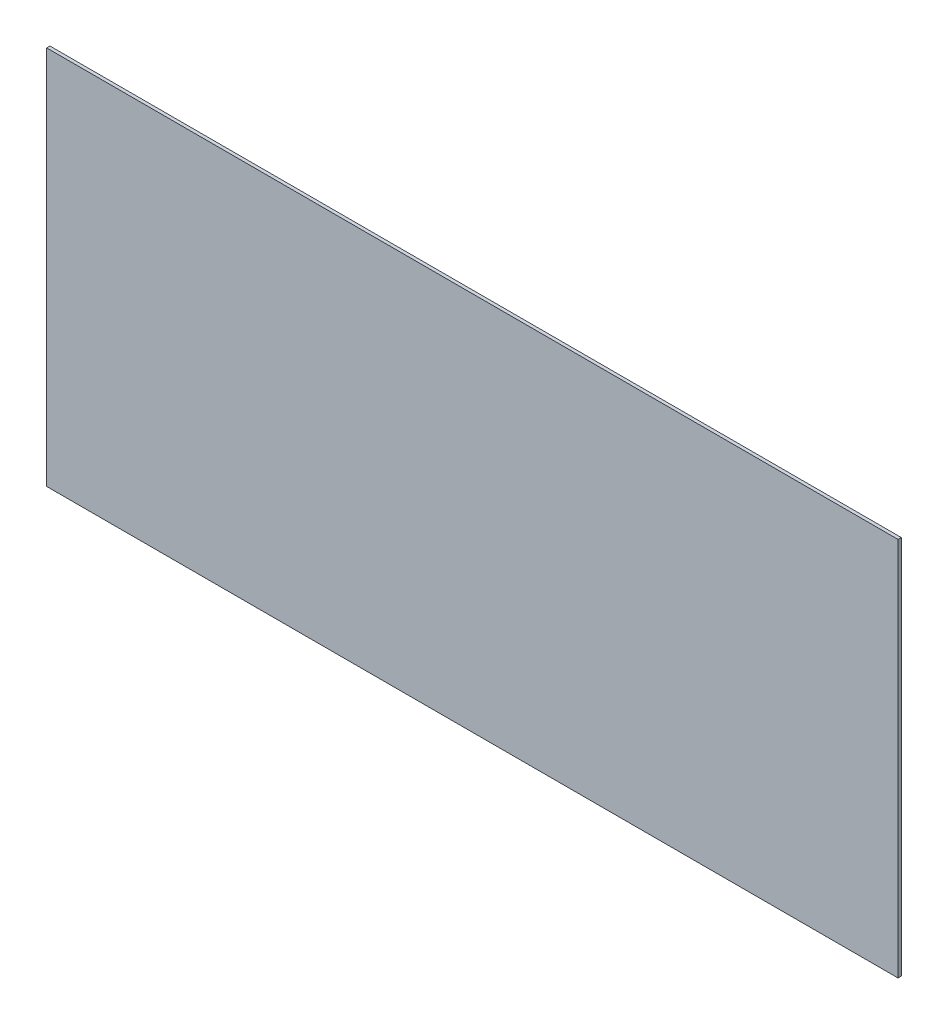
from build123d import *

# Parameters (mm, degrees)
ESQUISSE1_W        = 26
ESQUISSE1_H        = 11.6
BOSS_EXTRU_1_DEPTH = 0.1


with BuildPart() as part:
    # Esquisse1 → Boss.-Extru.1 (new body)
    with BuildSketch(Plane.XY):
        with Locations((13, 5.8)):
            Rectangle(ESQUISSE1_W, ESQUISSE1_H)
    extrude(amount=BOSS_EXTRU_1_DEPTH)


solid = part.part
